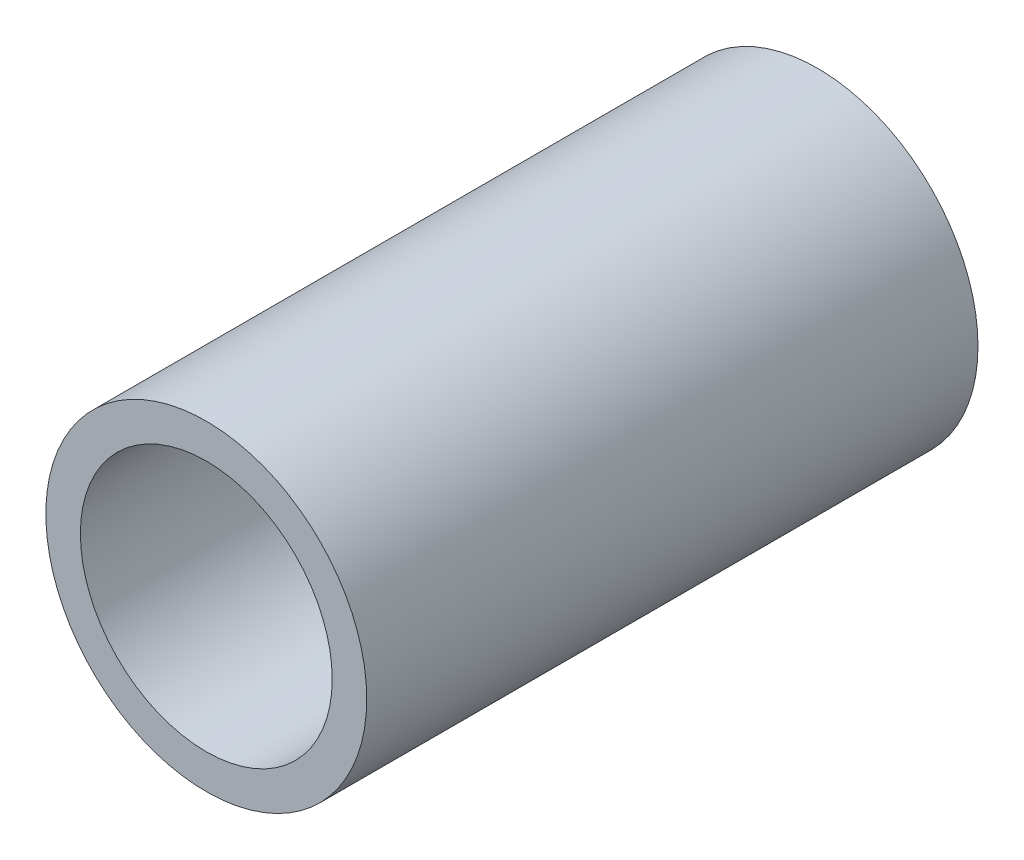
from build123d import *

# Parameters (mm, degrees)
SKETCH1_R           = 13.335
SKETCH1_R_2         = 10.4648
BOSS_EXTRUDE1_DEPTH = 25.4


with BuildPart() as part:
    # Sketch1 → Boss-Extrude1 (new, symmetric)
    with BuildSketch(Plane.XY):
        Circle(SKETCH1_R)
        Circle(SKETCH1_R_2, mode=Mode.SUBTRACT)
    extrude(amount=BOSS_EXTRUDE1_DEPTH, both=True)


solid = part.part
